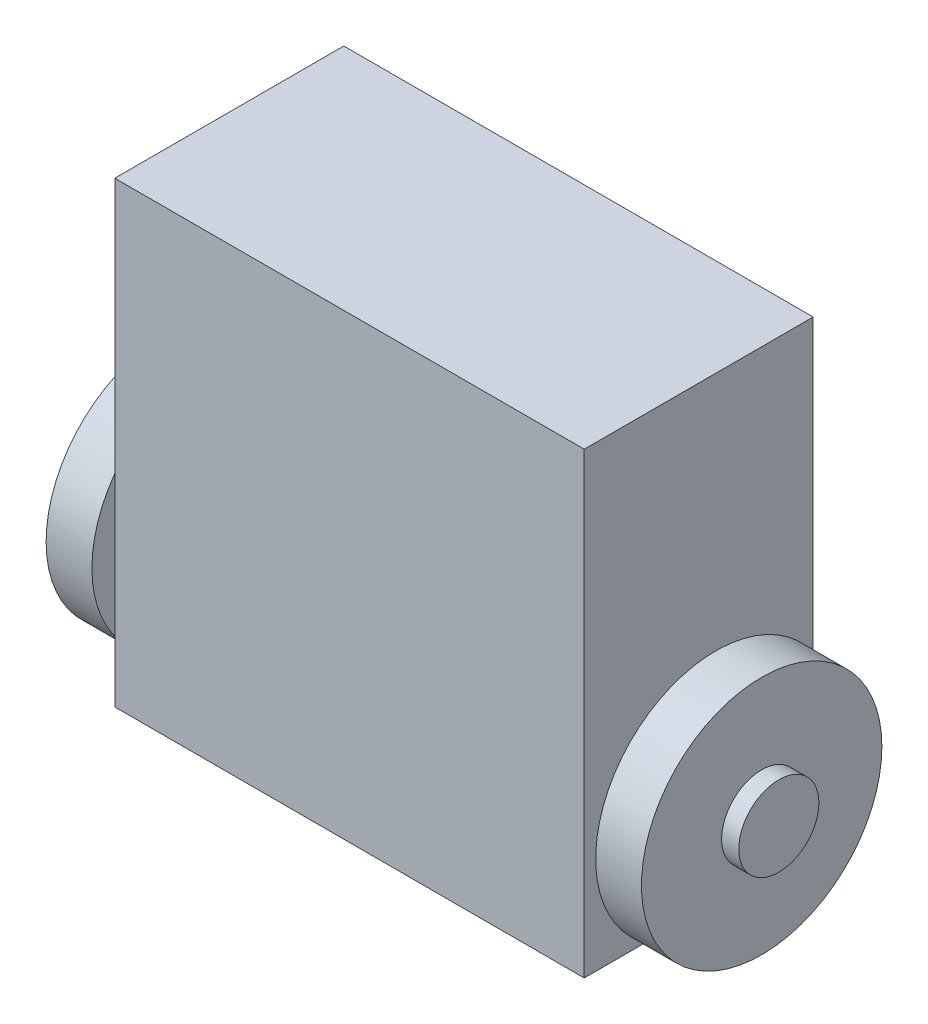
from build123d import *

# Parameters (mm, degrees)
CROQUIS1_W              = 41
CROQUIS1_H              = 40
SALIENTE_EXTRUIR1_DEPTH = 20
CROQUIS2_R              = 3.5
SALIENTE_EXTRUIR2_DEPTH = 1.5
SALIENTE_EXTRUIR3_START = 1.5
CROQUIS3_R              = 3.5
SALIENTE_EXTRUIR3_DEPTH = 1.5
CROQUIS4_R              = 10.5
SALIENTE_EXTRUIR4_DEPTH = 4
SALIENTE_EXTRUIR5_START = 4
CROQUIS5_R              = 10.5
SALIENTE_EXTRUIR5_DEPTH = 4
SALIENTE_EXTRUIR8_START = 1.5
CROQUIS8_R              = 3.5
SALIENTE_EXTRUIR8_DEPTH = 1.5
CROQUIS9_R              = 3.5
SALIENTE_EXTRUIR9_DEPTH = 1.5


with BuildPart() as part:
    # Croquis1 → Saliente-Extruir1 (new body)
    with BuildSketch(Plane.XY):
        Rectangle(CROQUIS1_W, CROQUIS1_H)
    extrude(amount=SALIENTE_EXTRUIR1_DEPTH)

    # Croquis2 → Saliente-Extruir2 (add)
    with BuildSketch(Plane(origin=(20.5, 0, 0), x_dir=(0, 0, -1), z_dir=(1, 0, 0))):
        with Locations(Location((-10, -10, 0), (0, 0, 180))):
            Circle(CROQUIS2_R)
    extrude(amount=SALIENTE_EXTRUIR2_DEPTH)

    # Croquis3 → Saliente-Extruir3 (add)
    with BuildSketch(Plane.ZY.offset(20.5).offset(SALIENTE_EXTRUIR3_START)):
        with Locations((10, -10)):
            Circle(CROQUIS3_R)
    extrude(amount=-SALIENTE_EXTRUIR3_DEPTH)

    # Croquis4 → Saliente-Extruir4 (add)
    with BuildSketch(Plane(origin=(22, 0, 0), x_dir=(0, 0, -1), z_dir=(1, 0, 0))):
        with Locations((-10, -10)):
            Circle(CROQUIS4_R)
    extrude(amount=SALIENTE_EXTRUIR4_DEPTH)

    # Croquis5 → Saliente-Extruir5 (add)
    with BuildSketch(Plane.ZY.offset(22).offset(SALIENTE_EXTRUIR5_START)):
        with Locations(Location((10, -10, 0), (0, 0, 180))):
            Circle(CROQUIS5_R)
    extrude(amount=-SALIENTE_EXTRUIR5_DEPTH)

    # Croquis8 → Saliente-Extruir8 (add)
    with BuildSketch(Plane.ZY.offset(26).offset(SALIENTE_EXTRUIR8_START)):
        with Locations((10, -10)):
            Circle(CROQUIS8_R)
    extrude(amount=-SALIENTE_EXTRUIR8_DEPTH)

    # Croquis9 → Saliente-Extruir9 (add)
    with BuildSketch(Plane(origin=(26, 0, 0), x_dir=(0, 0, -1), z_dir=(1, 0, 0))):
        with Locations(Location((-10, -10, 0), (0, 0, 180))):
            Circle(CROQUIS9_R)
    extrude(amount=SALIENTE_EXTRUIR9_DEPTH)


solid = part.part
